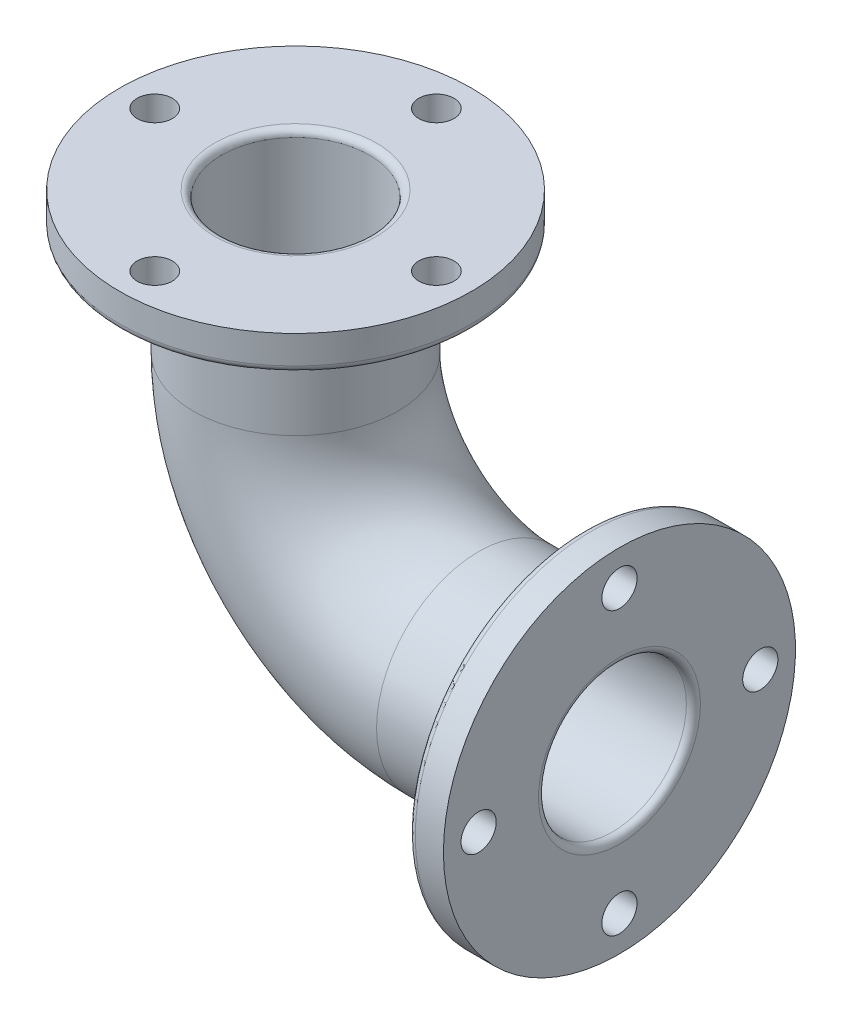
from build123d import *

# Parameters (mm, degrees)
SWEEP_THIN1_PROFILE_R   = 3683
SWEEP_THIN1_PROFILE_R_2 = 2667
BOSS_EXTRUDE1_START     = 1270
SKETCH40_R              = 6350
SKETCH40_R_2            = 2667
BOSS_EXTRUDE1_DEPTH     = 1270
SKETCH41_R              = 6350
SKETCH41_R_2            = 2667
BOSS_EXTRUDE2_DEPTH     = 1270
SKETCH42_R              = 635
CUT_EXTRUDE1_DEPTH      = 1270
SKETCH43_R              = 635
SKETCH43_R_2            = 634.999999999
CUT_EXTRUDE2_DEPTH      = 1270
FILLET1_R               = 254


with BuildPart() as part:
    # Sweep-Thin1: sweep along a path in Sketch2
    with BuildLine(Plane.XY) as sweep_thin1_path:
        Line((0, 3810), (0, 0))
        ThreePointArc((0, 0), (1934.266817044, -4669.733182956), (6604, -6604))
        Line((6604, -6604), (10414, -6604))
    # Sweep-Thin1 profile (on start of the path) → Sweep-Thin1 (sweep)
    with BuildSketch(Plane(origin=(0, 3810, 0), x_dir=(0, 0, -1), z_dir=(0, -1, 0))):
        Circle(SWEEP_THIN1_PROFILE_R)
        Circle(SWEEP_THIN1_PROFILE_R_2, mode=Mode.SUBTRACT)
    sweep(path=sweep_thin1_path.line)

    # Sketch40 → Boss-Extrude1 (add)
    with BuildSketch(Plane(origin=(10414, 0, 0), x_dir=(0, 0, -1), z_dir=(1, 0, 0)).offset(BOSS_EXTRUDE1_START)):
        with Locations(Location((0, -6604, 0), (0, 0, 180))):
            Circle(SKETCH40_R)
        with Locations((0, -6604)):
            Circle(SKETCH40_R_2, mode=Mode.SUBTRACT)
    extrude(amount=-BOSS_EXTRUDE1_DEPTH)

    # Sketch41 → Boss-Extrude2 (add)
    with BuildSketch(Plane(origin=(0, 3810, 0), x_dir=(1, 0, 0), z_dir=(0, 1, 0))):
        with Locations(Location((0, 0, 0), (0, 0, 90))):
            Circle(SKETCH41_R)
        with Locations(Location((0, 0, 0), (0, 0, 180))):
            Circle(SKETCH41_R_2, mode=Mode.SUBTRACT)
    extrude(amount=BOSS_EXTRUDE2_DEPTH)

    # Sketch42 → Cut-Extrude1 (cut)
    with BuildSketch(Plane(origin=(0, 5080, 0), x_dir=(1, 0, 0), z_dir=(0, 1, 0))):
        with Locations(Location((0, 5080, 0), (0, 0, 270))):
            Circle(SKETCH42_R)
        with Locations(Location((5080, 0, 0), (0, 0, 270))):
            Circle(SKETCH42_R)
        with Locations(Location((0, -5080, 0), (0, 0, 270))):
            Circle(SKETCH42_R)
        with Locations(Location((-5080, 0, 0), (0, 0, 270))):
            Circle(SKETCH42_R)
    extrude(amount=-CUT_EXTRUDE1_DEPTH, mode=Mode.SUBTRACT)

    # Sketch43 → Cut-Extrude2 (cut)
    with BuildSketch(Plane(origin=(11684, 0, 0), x_dir=(0, 0, -1), z_dir=(1, 0, 0))):
        with Locations((0, -1524)):
            Circle(SKETCH43_R)
        with Locations((5080, -6604)):
            Circle(SKETCH43_R)
        with Locations((0, -11684)):
            Circle(SKETCH43_R_2)
        with Locations((-5080, -6604)):
            Circle(SKETCH43_R)
    extrude(amount=-CUT_EXTRUDE2_DEPTH, mode=Mode.SUBTRACT)

    # Fillet1
    fillet1_edges = [part.edges().sort_by_distance(p)[0] for p in [
        (10414, -6604, 3683),
        (10414, -6604, -6350),
        (11684, -6604, 2667),
        (0, 3810, 6350),
        (2667, 5080, 0),
        (0, 3810, 3683),
    ]]
    fillet(fillet1_edges, radius=FILLET1_R)


solid = part.part
